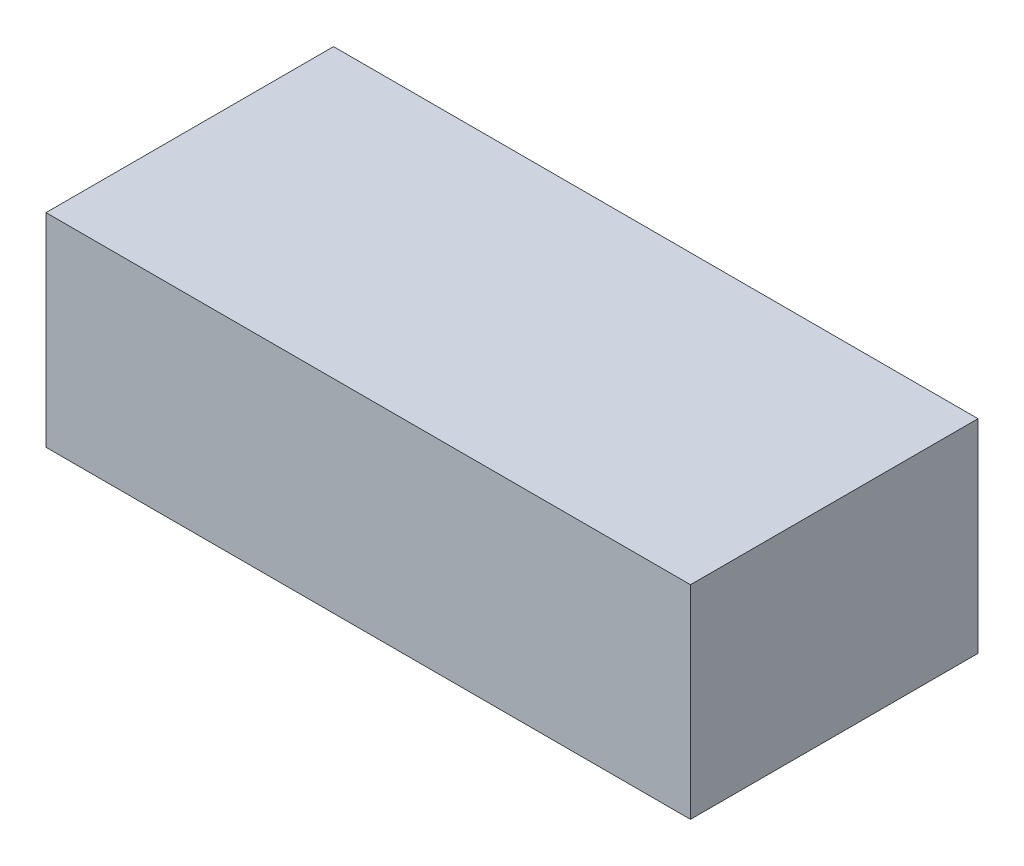
from build123d import *

# Parameters (mm, degrees)
SKETCH_1_W      = 65
SKETCH_1_H      = 29
EXTRUDE_1_DEPTH = 20.5


with BuildPart() as part:
    # 草图1 → 凸台-拉伸1 (new body)
    with BuildSketch(Plane(origin=(0, 0, 0), x_dir=(1, 0, 0), z_dir=(0, 1, 0))):
        Rectangle(SKETCH_1_W, SKETCH_1_H)
    extrude(amount=EXTRUDE_1_DEPTH)


solid = part.part
